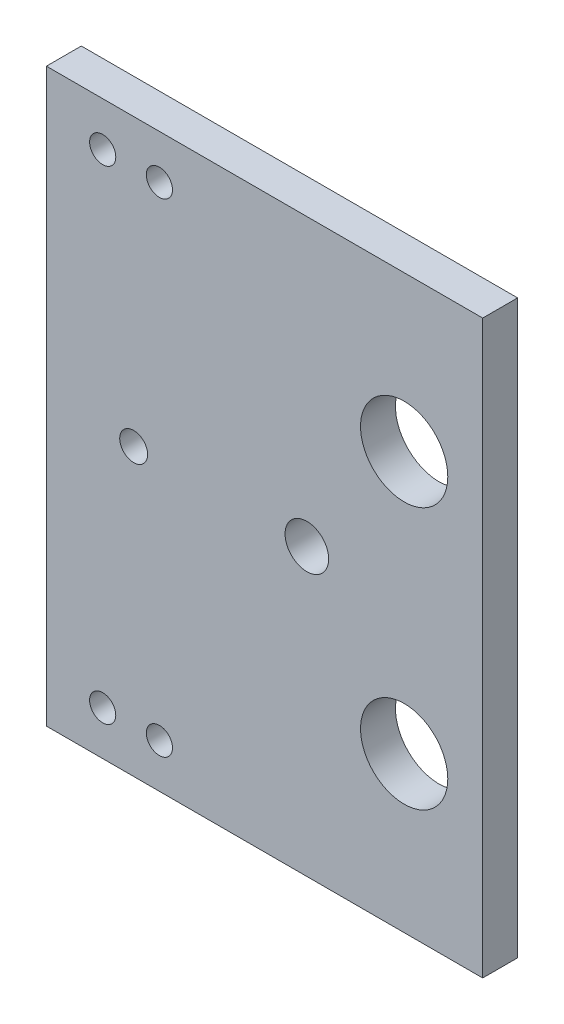
from build123d import *

# Parameters (mm, degrees)
SKETCH1_W           = 50
SKETCH1_H           = 65.5
BOSS_EXTRUDE1_DEPTH = 4
SKETCH4_R           = 5
SKETCH4_R_2         = 1.5
SKETCH4_R_3         = 1.6
SKETCH4_R_4         = 2.5
CUT_EXTRUDE2_DEPTH  = 10


with BuildPart() as part:
    # Sketch1 → Boss-Extrude1 (new body)
    with BuildSketch(Plane.XY):
        with Locations((-25, 32.75)):
            Rectangle(SKETCH1_W, SKETCH1_H)
    extrude(amount=BOSS_EXTRUDE1_DEPTH)

    # Sketch4 → Cut-Extrude2 (cut)
    with BuildSketch(Plane.XY.offset(4)):
        with Locations((-9, 47.75)):
            Circle(SKETCH4_R)
        with Locations((-37.05, 60.45)):
            Circle(SKETCH4_R_2)
        with Locations((-43.55, 60.45)):
            Circle(SKETCH4_R_2)
        with Locations((-40, 32.75)):
            Circle(SKETCH4_R_3)
        with Locations((-20.15, 32.75)):
            Circle(SKETCH4_R_4)
        with Locations((-9, 17.75)):
            Circle(SKETCH4_R)
        with Locations((-37.05, 5.05)):
            Circle(SKETCH4_R_2)
        with Locations((-43.55, 5.05)):
            Circle(SKETCH4_R_2)
    extrude(amount=-CUT_EXTRUDE2_DEPTH, mode=Mode.SUBTRACT)


solid = part.part
